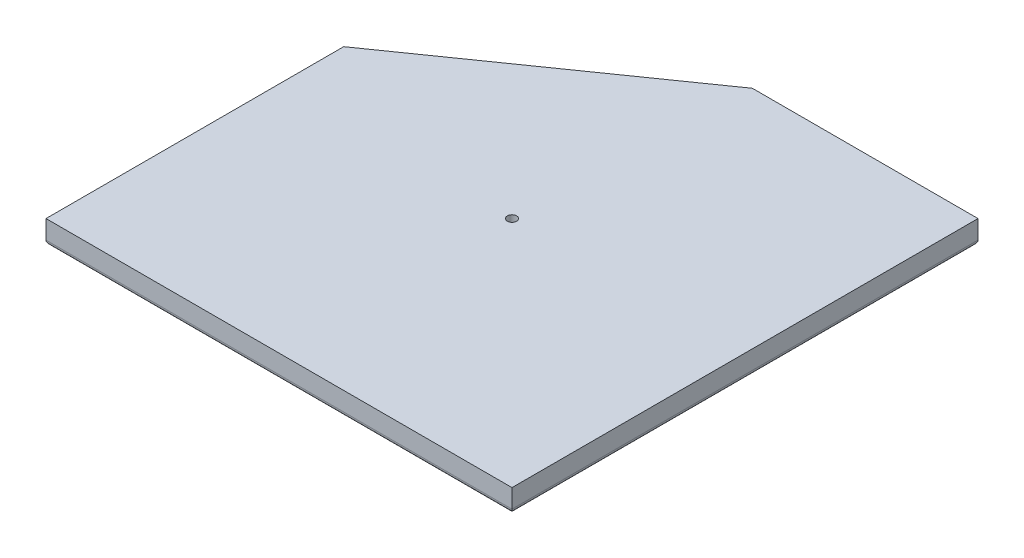
from build123d import *

# Parameters (mm, degrees)
BOSS_EXTRUDE1_DEPTH = 5
SKETCH2_R           = 1
CUT_EXTRUDE2_DEPTH  = 5
FILLET1_R           = 1


with BuildPart() as part:
    # Sketch1 → Boss-Extrude1 (new body)
    with BuildSketch(Plane(origin=(0, 0, 0), x_dir=(1, 0, 0), z_dir=(0, 1, 0))):
        Polygon((0, 0), (100, 0), (100, 100), (51.57649394, 100), (0, 63.88575015), align=None)
    extrude(amount=BOSS_EXTRUDE1_DEPTH)

    # Sketch2 → Cut-Extrude2 (cut)
    with BuildSketch(Plane(origin=(0, 0, 0), x_dir=(1, 0, 0), z_dir=(0, 1, 0))):
        with Locations(Location((50, 50, 0), (0, 0, 270))):
            Circle(SKETCH2_R)
    extrude(amount=CUT_EXTRUDE2_DEPTH, mode=Mode.SUBTRACT)

    # Fillet1
    fillet1_edges = [part.edges().sort_by_distance(p)[0] for p in [
        (25.78824697, 0, -81.942875075),
        (75.78824697, 0, -100),
        (100, 0, -50),
        (50, 0, 0),
        (0, 0, -31.942875075),
    ]]
    fillet(fillet1_edges, radius=FILLET1_R)


solid = part.part
